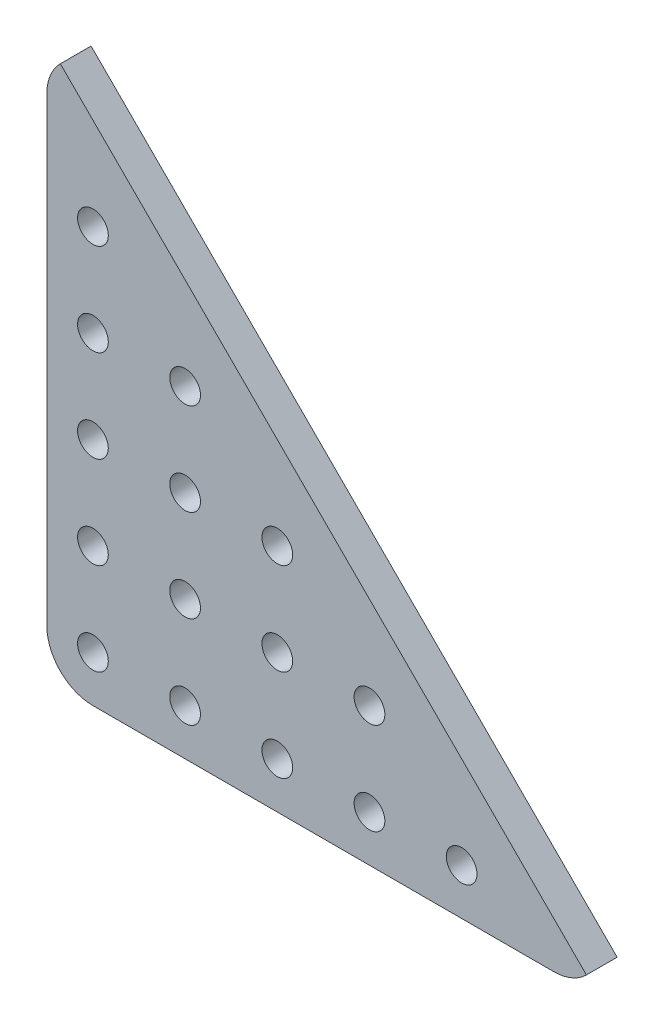
from build123d import *

# Parameters (mm, degrees)
MODEL_R                 = 1.5
SALIENTE_EXTRUIR1_DEPTH = 3


with BuildPart() as part:
    # Model → Saliente-Extruir1 (new body)
    with BuildSketch(Plane.XY):
        with BuildLine():
            Line((-105.943383637, 101.056539338), (-105.943383637, 56.056539338))
            ThreePointArc((-105.943383637, 56.056539338), (-104.625364152, 52.874558823), (-101.443383637, 51.556539338))
            Line((-101.443383637, 51.556539338), (-56.443383637, 51.556539338))
            ThreePointArc((-56.443383637, 51.556539338), (-54.721308191, 51.899081442), (-53.261403122, 52.874558823))
            Line((-53.261403122, 52.874558823), (-104.625364152, 104.238519853))
            ThreePointArc((-104.625364152, 104.238519853), (-105.600841533, 102.778614784), (-105.943383637, 101.056539338))
        make_face()
        with Locations((-101.443383637, 92.056539338)):
            Circle(MODEL_R, mode=Mode.SUBTRACT)
        with Locations((-101.443383637, 83.056539338)):
            Circle(MODEL_R, mode=Mode.SUBTRACT)
        with Locations((-92.443383637, 83.056539338)):
            Circle(MODEL_R, mode=Mode.SUBTRACT)
        with Locations((-101.443383637, 74.056539338)):
            Circle(MODEL_R, mode=Mode.SUBTRACT)
        with Locations((-92.443383637, 74.056539338)):
            Circle(MODEL_R, mode=Mode.SUBTRACT)
        with Locations((-83.443383637, 74.056539338)):
            Circle(MODEL_R, mode=Mode.SUBTRACT)
        with Locations((-101.443383637, 65.056539338)):
            Circle(MODEL_R, mode=Mode.SUBTRACT)
        with Locations((-92.443383637, 65.056539338)):
            Circle(MODEL_R, mode=Mode.SUBTRACT)
        with Locations((-83.443383637, 65.056539338)):
            Circle(MODEL_R, mode=Mode.SUBTRACT)
        with Locations((-74.443383637, 65.056539338)):
            Circle(MODEL_R, mode=Mode.SUBTRACT)
        with Locations((-101.443383637, 56.056539338)):
            Circle(MODEL_R, mode=Mode.SUBTRACT)
        with Locations((-92.443383637, 56.056539338)):
            Circle(MODEL_R, mode=Mode.SUBTRACT)
        with Locations((-83.443383637, 56.056539338)):
            Circle(MODEL_R, mode=Mode.SUBTRACT)
        with Locations((-74.443383637, 56.056539338)):
            Circle(MODEL_R, mode=Mode.SUBTRACT)
        with Locations((-65.443383637, 56.056539338)):
            Circle(MODEL_R, mode=Mode.SUBTRACT)
    extrude(amount=SALIENTE_EXTRUIR1_DEPTH)


solid = part.part
